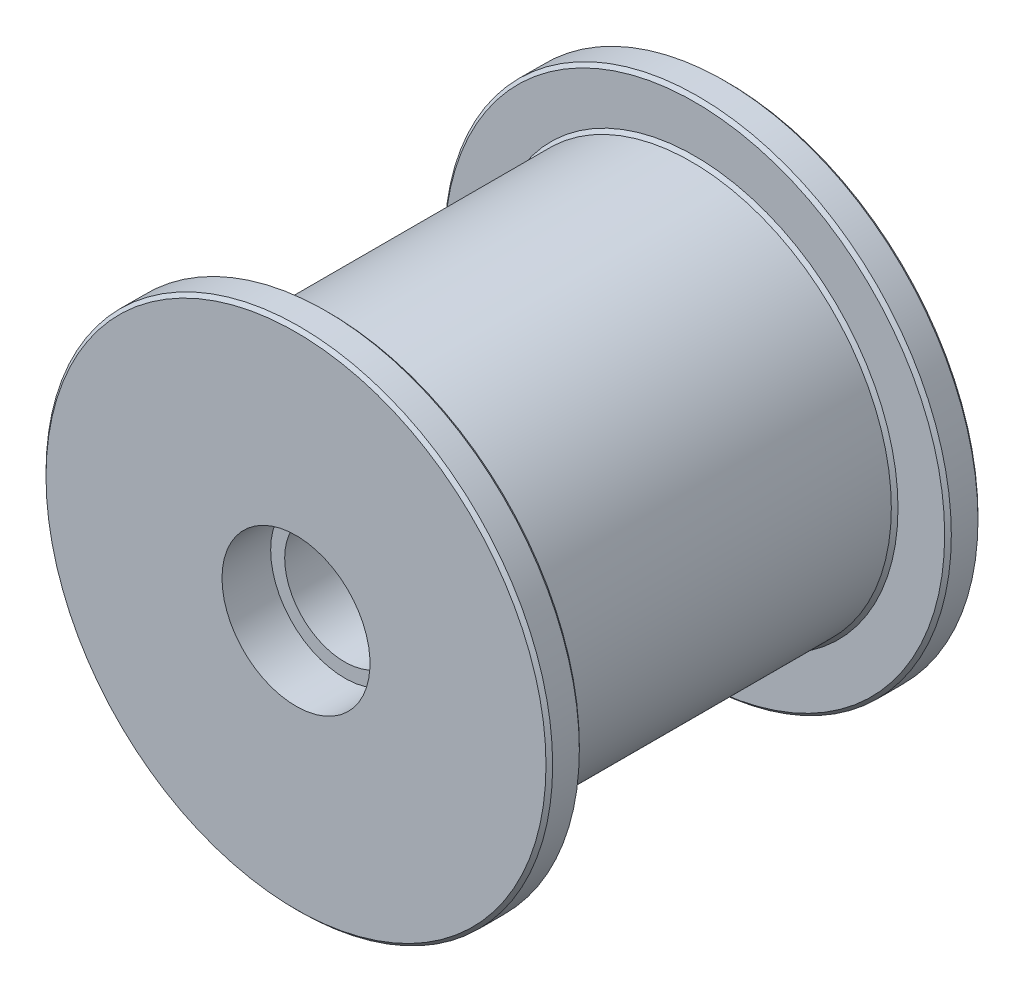
from build123d import *

# Parameters (mm, degrees)
CHAMFER1_SIZE = 0.5


with BuildPart() as part:
    # Sketch1 → Revolve1 (revolve)
    with BuildSketch(Plane(origin=(0, 0, 0), x_dir=(1, 0, 0), z_dir=(0, 1, 0)), mode=Mode.PRIVATE) as revolve1_sk:
        Polygon((0, 0), (0, 64.8), (-38, 64.8), (-38, 59.8), (-30, 59.8), (-30, 5), (-38, 5), (-38, 0), align=None)
    revolve(revolve1_sk.sketch.rotate(Axis((0, 0, 0), (0, 0, -1)), 180), axis=Axis((0, 0, 0), (0, 0, -1)))

    # Sketch7 → Cut-Revolve1 (revolve, cut)
    with BuildSketch(Plane(origin=(0, 0, 0), x_dir=(1, 0, 0), z_dir=(0, 1, 0))):
        Polygon((0, 64.8), (-11.1, 64.8), (-11.1, 57.5), (-9, 57.5), (-9, 7.3), (-11.1, 7.3), (-11.1, 0), (0, 0), align=None)
    revolve(axis=Axis((0, 0, -64.8), (0, 0, 1)), mode=Mode.SUBTRACT)

    # Chamfer1
    chamfer1_edges = [part.edges().sort_by_distance(p)[0] for p in [
        (-38, 0, 0),
        (-38, 0, -5),
        (-30, 0, -5),
        (-30, 0, -59.8),
        (-38, 0, -59.8),
        (-38, 0, -64.8),
    ]]
    chamfer(chamfer1_edges, length=CHAMFER1_SIZE)


solid = part.part
